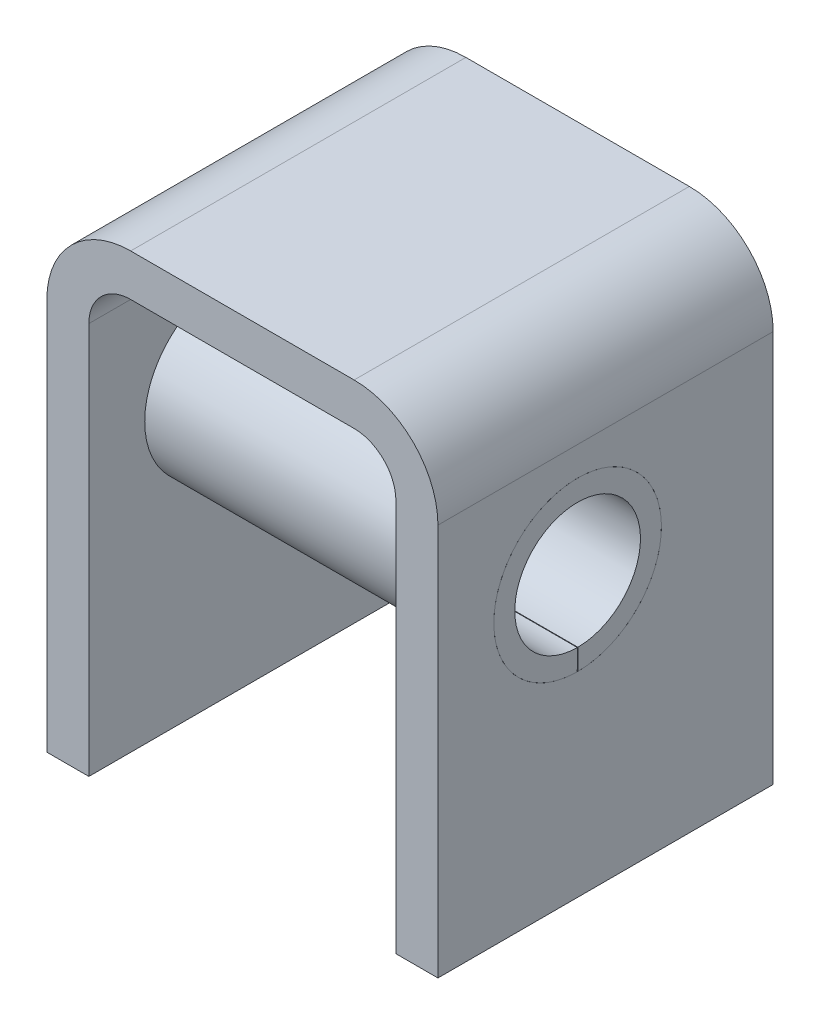
from build123d import *

# Parameters (mm, degrees)
BOSS_EXTRUDE1_DEPTH = 19.05
SKETCH2_R           = 9.525
CUT_EXTRUDE1_DEPTH  = 73.565359532
BOSS_EXTRUDE2_DEPTH = 22.225


with BuildPart() as part:
    # Sketch1 → Boss-Extrude1 (new, symmetric)
    with BuildSketch(Plane.XY):
        with BuildLine():
            Line((-17.4498, -9.525), (-17.4498, -54.102))
            Line((-17.4498, -54.102), (-22.225, -54.102))
            Line((-22.225, -54.102), (-22.225, -9.525))
            ThreePointArc((-22.225, -9.525), (-19.435192091, -2.789807909), (-12.7, 0))
            Line((-12.7, 0), (12.7, 0))
            ThreePointArc((12.7, 0), (19.435192091, -2.789807909), (22.225, -9.525))
            Line((22.225, -9.525), (22.225, -54.102))
            Line((22.225, -54.102), (17.4498, -54.102))
            Line((17.4498, -54.102), (17.4498, -9.525))
            ThreePointArc((17.4498, -9.525), (16.058615789, -6.166384211), (12.7, -4.7752))
            Line((12.7, -4.7752), (-12.7, -4.7752))
            ThreePointArc((-12.7, -4.7752), (-16.058615789, -6.166384211), (-17.4498, -9.525))
        make_face()
    extrude(amount=BOSS_EXTRUDE1_DEPTH, both=True)

    # Sketch2 → Cut-Extrude1 (cut, through all)
    with BuildSketch(Plane(origin=(22.225, 0, 0), x_dir=(0, 0, -1), z_dir=(1, 0, 0))):
        with Locations(Location((-3.175, -22.352, 0), (0, 0, 90))):
            Circle(SKETCH2_R)
    extrude(amount=-CUT_EXTRUDE1_DEPTH, mode=Mode.SUBTRACT)


with BuildPart() as body_2:
    # Sketch3 → Boss-Extrude2 (new, symmetric)
    with BuildSketch(Plane(origin=(0, 0, 0), x_dir=(0, 0, -1), z_dir=(1, 0, 0))):
        with BuildLine():
            Line((-3.143829609, -29.495681997), (-3.133439479, -31.876909329))
            ThreePointArc((-3.133439479, -31.876909329), (-3.175, -12.827), (-3.216560521, -31.876909329))
            Line((-3.216560521, -31.876909329), (-3.206170391, -29.495681997))
            ThreePointArc((-3.206170391, -29.495681997), (-3.175, -15.20825), (-3.143829609, -29.495681997))
        make_face()
    extrude(amount=BOSS_EXTRUDE2_DEPTH, both=True)


solid = Compound([part.part, body_2.part])
